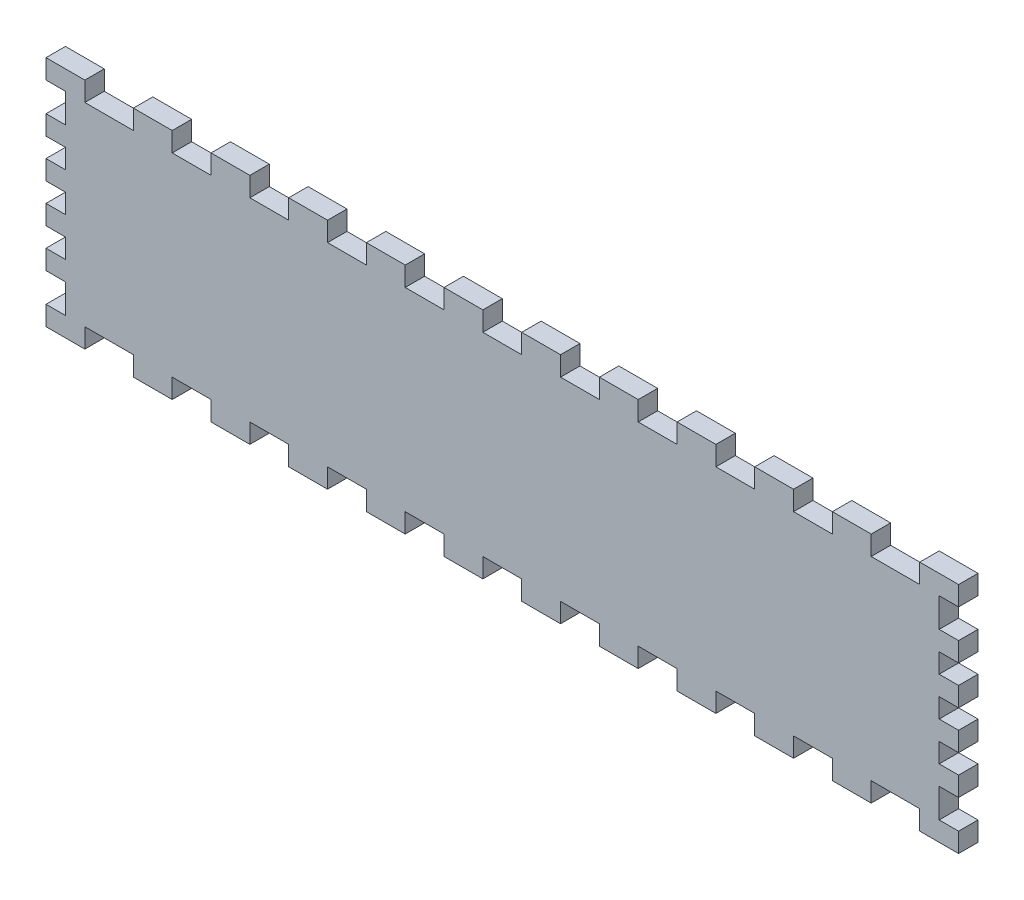
from build123d import *

# Parameters (mm, degrees)
SKETCH1_W               = 298.45
SKETCH1_H               = 76.2
BOSS_EXTRUDE1_DEPTH     = 6.35
SKETCH2_W               = 12.7
SKETCH2_H               = 25.4
CUT_EXTRUDE5_DEPTH      = 155.142898393
LPATTERN1_COUNT         = 9
LPATTERN1_PITCH         = 25.4
MIRROR1_COPY_1_SKETCH_W = 12.7
MIRROR1_COPY_1_SKETCH_H = 25.4
MIRROR1_COPY_1_DEPTH    = 155.142898393
MIRROR1_COPY_2_SKETCH_W = 12.7
MIRROR1_COPY_2_SKETCH_H = 25.4
MIRROR1_COPY_2_DEPTH    = 155.142898393
MIRROR1_COPY_3_SKETCH_W = 12.7
MIRROR1_COPY_3_SKETCH_H = 25.4
MIRROR1_COPY_3_DEPTH    = 155.142898393
MIRROR1_COPY_4_SKETCH_W = 12.7
MIRROR1_COPY_4_SKETCH_H = 25.4
MIRROR1_COPY_4_DEPTH    = 155.142898393
MIRROR1_COPY_5_SKETCH_W = 12.7
MIRROR1_COPY_5_SKETCH_H = 25.4
MIRROR1_COPY_5_DEPTH    = 155.142898393
MIRROR1_COPY_6_SKETCH_W = 12.7
MIRROR1_COPY_6_SKETCH_H = 25.4
MIRROR1_COPY_6_DEPTH    = 155.142898393
MIRROR1_COPY_7_SKETCH_W = 12.7
MIRROR1_COPY_7_SKETCH_H = 25.4
MIRROR1_COPY_7_DEPTH    = 155.142898393
MIRROR1_COPY_8_SKETCH_W = 12.7
MIRROR1_COPY_8_SKETCH_H = 25.4
MIRROR1_COPY_8_DEPTH    = 155.142898393
SKETCH3_W               = 40.748476415
SKETCH3_H               = 6.35
SKETCH3_W_2             = 25.4
SKETCH3_H_2             = 9.525
CUT_EXTRUDE7_DEPTH      = 155.142898393
SKETCH4_W               = 15.875
SKETCH4_H               = 25.4
CUT_EXTRUDE8_DEPTH      = 155.142898393


with BuildPart() as part:
    # Sketch1 → Boss-Extrude1 (new body)
    with BuildSketch(Plane.XY):
        Rectangle(SKETCH1_W, SKETCH1_H)
    extrude(amount=BOSS_EXTRUDE1_DEPTH)

    # Sketch2 → Cut-Extrude5 (cut, symmetric)
    with BuildSketch(Plane.XY):
        with Locations((101.6, -44.45)):
            Rectangle(SKETCH2_W, SKETCH2_H)
    cut_extrude5 = extrude(amount=CUT_EXTRUDE5_DEPTH, both=True, mode=Mode.SUBTRACT)

    # LPattern1: Cut-Extrude5 ×9
    with Locations(*[(-i * LPATTERN1_PITCH, 0, 0) for i in range(1, LPATTERN1_COUNT)]):
        add(cut_extrude5, mode=Mode.SUBTRACT)

    # Mirror1: Cut-Extrude5 across plane
    add(cut_extrude5.mirror(Plane.ZX), mode=Mode.SUBTRACT)

    # Mirror1 copy 1 sketch → Mirror1 copy 1 (cut, symmetric)
    with BuildSketch(Plane(origin=(-25.4, 0, 0), x_dir=(1, 0, 0), z_dir=(0, 0, 1))):
        with Locations((101.6, 44.45)):
            Rectangle(MIRROR1_COPY_1_SKETCH_W, MIRROR1_COPY_1_SKETCH_H)
    extrude(amount=MIRROR1_COPY_1_DEPTH, both=True, mode=Mode.SUBTRACT)

    # Mirror1 copy 2 sketch → Mirror1 copy 2 (cut, symmetric)
    with BuildSketch(Plane(origin=(-50.8, 0, 0), x_dir=(1, 0, 0), z_dir=(0, 0, 1))):
        with Locations((101.6, 44.45)):
            Rectangle(MIRROR1_COPY_2_SKETCH_W, MIRROR1_COPY_2_SKETCH_H)
    extrude(amount=MIRROR1_COPY_2_DEPTH, both=True, mode=Mode.SUBTRACT)

    # Mirror1 copy 3 sketch → Mirror1 copy 3 (cut, symmetric)
    with BuildSketch(Plane(origin=(-76.2, 0, 0), x_dir=(1, 0, 0), z_dir=(0, 0, 1))):
        with Locations((101.6, 44.45)):
            Rectangle(MIRROR1_COPY_3_SKETCH_W, MIRROR1_COPY_3_SKETCH_H)
    extrude(amount=MIRROR1_COPY_3_DEPTH, both=True, mode=Mode.SUBTRACT)

    # Mirror1 copy 4 sketch → Mirror1 copy 4 (cut, symmetric)
    with BuildSketch(Plane(origin=(-101.6, 0, 0), x_dir=(1, 0, 0), z_dir=(0, 0, 1))):
        with Locations((101.6, 44.45)):
            Rectangle(MIRROR1_COPY_4_SKETCH_W, MIRROR1_COPY_4_SKETCH_H)
    extrude(amount=MIRROR1_COPY_4_DEPTH, both=True, mode=Mode.SUBTRACT)

    # Mirror1 copy 5 sketch → Mirror1 copy 5 (cut, symmetric)
    with BuildSketch(Plane(origin=(-127, 0, 0), x_dir=(1, 0, 0), z_dir=(0, 0, 1))):
        with Locations((101.6, 44.45)):
            Rectangle(MIRROR1_COPY_5_SKETCH_W, MIRROR1_COPY_5_SKETCH_H)
    extrude(amount=MIRROR1_COPY_5_DEPTH, both=True, mode=Mode.SUBTRACT)

    # Mirror1 copy 6 sketch → Mirror1 copy 6 (cut, symmetric)
    with BuildSketch(Plane(origin=(-152.4, 0, 0), x_dir=(1, 0, 0), z_dir=(0, 0, 1))):
        with Locations((101.6, 44.45)):
            Rectangle(MIRROR1_COPY_6_SKETCH_W, MIRROR1_COPY_6_SKETCH_H)
    extrude(amount=MIRROR1_COPY_6_DEPTH, both=True, mode=Mode.SUBTRACT)

    # Mirror1 copy 7 sketch → Mirror1 copy 7 (cut, symmetric)
    with BuildSketch(Plane(origin=(-177.8, 0, 0), x_dir=(1, 0, 0), z_dir=(0, 0, 1))):
        with Locations((101.6, 44.45)):
            Rectangle(MIRROR1_COPY_7_SKETCH_W, MIRROR1_COPY_7_SKETCH_H)
    extrude(amount=MIRROR1_COPY_7_DEPTH, both=True, mode=Mode.SUBTRACT)

    # Mirror1 copy 8 sketch → Mirror1 copy 8 (cut, symmetric)
    with BuildSketch(Plane(origin=(-203.2, 0, 0), x_dir=(1, 0, 0), z_dir=(0, 0, 1))):
        with Locations((101.6, 44.45)):
            Rectangle(MIRROR1_COPY_8_SKETCH_W, MIRROR1_COPY_8_SKETCH_H)
    extrude(amount=MIRROR1_COPY_8_DEPTH, both=True, mode=Mode.SUBTRACT)

    # Sketch3 → Cut-Extrude7 (cut, through all)
    with BuildSketch(Plane.XY):
        with Locations((163.249238208, 12.7)):
            Rectangle(SKETCH3_W, SKETCH3_H)
        with Locations((163.249238208, 0)):
            Rectangle(SKETCH3_W, SKETCH3_H)
        with Locations((163.249238208, -12.7)):
            Rectangle(SKETCH3_W, SKETCH3_H)
        with Locations((155.575, 26.9875)):
            Rectangle(SKETCH3_W_2, SKETCH3_H_2)
        with Locations((155.575, -26.9875)):
            Rectangle(SKETCH3_W_2, SKETCH3_H_2)
    cut_extrude7 = extrude(amount=CUT_EXTRUDE7_DEPTH, mode=Mode.SUBTRACT)

    # Mirror2: Cut-Extrude7 across plane
    add(cut_extrude7.mirror(Plane(origin=(0, 0, 0), x_dir=(0, 0, 1), z_dir=(1, 0, 0))), mode=Mode.SUBTRACT)

    # Sketch4 → Cut-Extrude8 (cut, through all)
    with BuildSketch(Plane.XY.offset(6.35)):
        with Locations((128.5875, -44.45)):
            Rectangle(SKETCH4_W, SKETCH4_H)
        with Locations((-128.5875, -44.45)):
            Rectangle(SKETCH4_W, SKETCH4_H)
        with Locations((-128.5875, 44.45)):
            Rectangle(SKETCH4_W, SKETCH4_H)
        with Locations((128.5875, 44.45)):
            Rectangle(SKETCH4_W, SKETCH4_H)
    extrude(amount=-CUT_EXTRUDE8_DEPTH, mode=Mode.SUBTRACT)


solid = part.part
